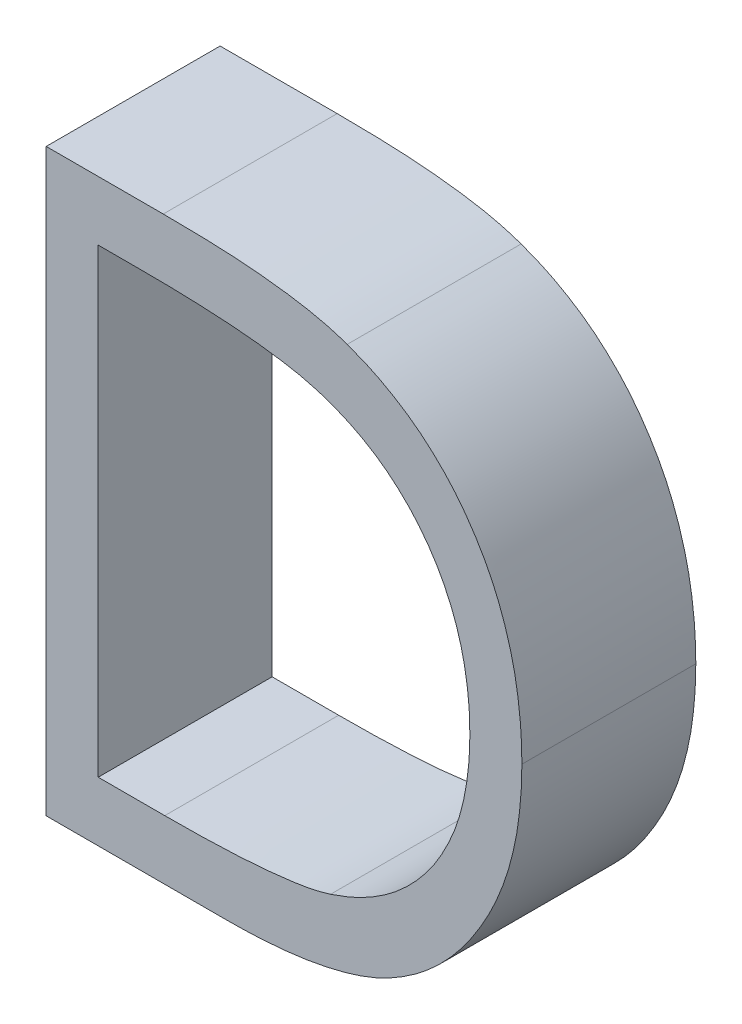
from build123d import *

# Parameters (mm, degrees)
BOSS_EXTRU_1_DEPTH = 1.5


with BuildPart() as part:
    # Esquisse1 → Boss.-Extru.1 (new body)
    with BuildSketch(Plane.XY):
        with BuildLine():
            Line((-55.432465326, -22.870119076), (-55.432465326, -17.870119076))
            Line((-55.432465326, -17.870119076), (-54.422849941, -17.870119076))
            add(Edge.make_bspline(
                [(-54.422849941, -17.870119076), (-54.335037101, -17.870751319), (-54.165383151, -17.871972809), (-53.920222511, -17.879717653), (-53.693388565, -17.893418319), (-53.485627338, -17.913374785), (-53.296368463, -17.937879119), (-53.12614188, -17.968593982), (-52.974067391, -18.004862797), (-52.880539618, -18.035784869), (-52.83631148, -18.050407538)],
                knots=[0, 0, 0, 0, 1.314313732, 2.53924729, 3.670748893, 4.714932338, 5.66265055, 6.526160246, 7.303039223, 8, 8, 8, 8], degree=3))
            add(Edge.make_bspline(
                [(-52.83631148, -18.050407538), (-52.778461852, -18.072451403), (-52.664074435, -18.116039252), (-52.501207117, -18.198262539), (-52.34788517, -18.291424113), (-52.203286391, -18.395646774), (-52.070713782, -18.513881558), (-51.944988215, -18.641105966), (-51.831252896, -18.781946452), (-51.727098187, -18.933482149), (-51.633190102, -19.093927938), (-51.551562734, -19.262978093), (-51.483771315, -19.439774105), (-51.427495277, -19.623824316), (-51.383143194, -19.815533427), (-51.352883292, -20.015124664), (-51.332924735, -20.221809221), (-51.330918947, -20.362058455), (-51.329901223, -20.433220038)],
                knots=[0, 0, 0, 0, 0.984719456, 1.947108742, 2.898477687, 3.838006223, 4.779231079, 5.722358779, 6.681677486, 7.655904652, 8.64651281, 9.637519902, 10.640069247, 11.656948941, 12.698408672, 13.768548281, 14.867775369, 16, 16, 16, 16], degree=3))
            add(Edge.make_bspline(
                [(-51.329901223, -20.433220038), (-51.330799748, -20.495021807), (-51.332570386, -20.616808648), (-51.348469408, -20.796295642), (-51.371578437, -20.970457887), (-51.407355862, -21.13846603), (-51.450788024, -21.301792055), (-51.506451098, -21.458695262), (-51.570216092, -21.610614989), (-51.644573062, -21.755497098), (-51.726203612, -21.892759058), (-51.813806102, -22.02215267), (-51.907287095, -22.141831558), (-52.007537999, -22.252158147), (-52.113263309, -22.352966116), (-52.225155209, -22.445097566), (-52.343502425, -22.526749787), (-52.467774886, -22.601131371), (-52.601597928, -22.666017593), (-52.747506308, -22.720917607), (-52.906122277, -22.766412772), (-53.077056501, -22.804371194), (-53.260604326, -22.834481627), (-53.456945706, -22.854662187), (-53.665778977, -22.868309234), (-53.809177927, -22.869504082), (-53.882986159, -22.870119076)],
                knots=[0, 0, 0, 0, 1.105936401, 2.179363191, 3.223086493, 4.248585256, 5.251745608, 6.245858792, 7.225916811, 8.198733463, 9.158002045, 10.082870192, 10.993790845, 11.873723703, 12.748670949, 13.606408763, 14.465103618, 15.319838547, 16.196477973, 17.123216899, 18.106603292, 19.147568657, 20.255746949, 21.433717677, 22.679120308, 24, 24, 24, 24], degree=3))
            Line((-53.882986159, -22.870119076), (-55.432465326, -22.870119076))
        make_face()
        with BuildLine():
            Line((-54.983747377, -22.357298563), (-54.409829108, -22.357298563))
            add(Edge.make_bspline(
                [(-54.409829108, -22.357298563), (-54.327360007, -22.35694414), (-54.168741723, -22.356262454), (-53.94065887, -22.350280735), (-53.732259732, -22.340506539), (-53.543514719, -22.326827856), (-53.374530398, -22.308729835), (-53.224953613, -22.288551402), (-53.095274672, -22.263412187), (-53.016804048, -22.240625102), (-52.980542249, -22.230095038)],
                knots=[0, 0, 0, 0, 1.375205317, 2.645023457, 3.804390687, 4.853969522, 5.800190428, 6.637939096, 7.370582563, 8, 8, 8, 8], degree=3))
            add(Edge.make_bspline(
                [(-52.980542249, -22.230095038), (-52.934901732, -22.214021383), (-52.84471082, -22.182257993), (-52.714880698, -22.124318477), (-52.593799263, -22.055686949), (-52.47935637, -21.979397986), (-52.373175433, -21.89276084), (-52.273998124, -21.797659427), (-52.182024123, -21.693609749), (-52.098203683, -21.580740947), (-52.02319182, -21.459755524), (-51.95823292, -21.331842905), (-51.901302161, -21.198404604), (-51.856618457, -21.057391521), (-51.821596194, -20.910064294), (-51.796789497, -20.756412561), (-51.781339891, -20.596465016), (-51.779537822, -20.487676267), (-51.778619172, -20.432218435)],
                knots=[0, 0, 0, 0, 0.998632004, 1.973411704, 2.929992603, 3.868527914, 4.809262121, 5.754881198, 6.702106254, 7.672490631, 8.653608572, 9.636854334, 10.631411391, 11.644891563, 12.686317036, 13.754757253, 14.855430412, 16, 16, 16, 16], degree=3))
            add(Edge.make_bspline(
                [(-51.778619172, -20.432218435), (-51.77935244, -20.373742035), (-51.780792951, -20.258864629), (-51.798899108, -20.090306492), (-51.825358473, -19.928191277), (-51.863620882, -19.772508141), (-51.91237928, -19.622953352), (-51.973228768, -19.480354052), (-52.04275251, -19.343204239), (-52.125471563, -19.214669431), (-52.216065268, -19.093107847), (-52.316605095, -18.981743682), (-52.425493722, -18.880323253), (-52.541543507, -18.787267092), (-52.668025077, -18.706318983), (-52.801958921, -18.633909439), (-52.94530988, -18.572458165), (-53.045042303, -18.539774076), (-53.095726544, -18.523163948)],
                knots=[0, 0, 0, 0, 1.122418816, 2.205001699, 3.251619955, 4.274784885, 5.280384055, 6.268708349, 7.249350384, 8.229342522, 9.199999885, 10.157847722, 11.105861043, 12.055065948, 13.010012805, 13.98527497, 14.976112212, 16, 16, 16, 16], degree=3))
            add(Edge.make_bspline(
                [(-53.095726544, -18.523163948), (-53.137656753, -18.511569051), (-53.226811882, -18.486915119), (-53.372296831, -18.46002173), (-53.536032758, -18.436301017), (-53.718746617, -18.416218103), (-53.92023013, -18.401807644), (-54.140638256, -18.39099148), (-54.380066262, -18.383696291), (-54.546041311, -18.383198138), (-54.632184877, -18.382939589)],
                knots=[0, 0, 0, 0, 0.674548936, 1.434276114, 2.292660221, 3.240891867, 4.284742987, 5.42552168, 6.663806718, 8, 8, 8, 8], degree=3))
            Line((-54.632184877, -18.382939589), (-54.983747377, -18.382939589))
            Line((-54.983747377, -18.382939589), (-54.983747377, -22.357298563))
        make_face(mode=Mode.SUBTRACT)
    extrude(amount=BOSS_EXTRU_1_DEPTH)


solid = part.part
